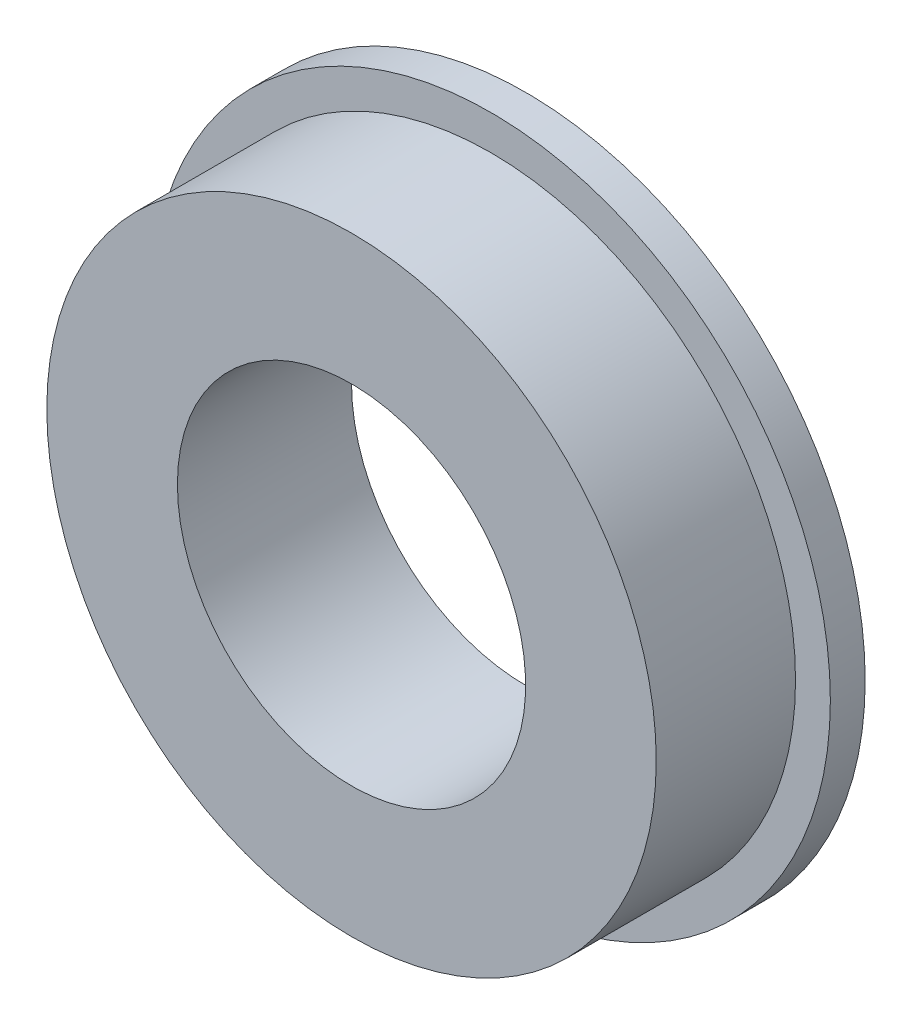
from build123d import *

# Parameters (mm, degrees)
SKETCH_1_R          = 7.8
EXTRUDE_1_DEPTH     = 0.8
SKETCH_2_R          = 7
EXTRUDE_2_DEPTH     = 3.2
SKETCH_3_R          = 4
CUT_EXTRUDE_1_DEPTH = 12.733712115


with BuildPart() as part:
    # 草图1 → 凸台-拉伸1 (new body)
    with BuildSketch(Plane.XY):
        Circle(SKETCH_1_R)
    extrude(amount=EXTRUDE_1_DEPTH)

    # 草图2 → 凸台-拉伸2 (add)
    with BuildSketch(Plane.XY.offset(0.8)):
        Circle(SKETCH_2_R)
    extrude(amount=EXTRUDE_2_DEPTH)

    # 草图3 → 切除-拉伸1 (cut, through all)
    with BuildSketch(Plane(origin=(0, 0, 0), x_dir=(-1, 0, 0), z_dir=(0, 0, -1))):
        Circle(SKETCH_3_R)
    extrude(amount=-CUT_EXTRUDE_1_DEPTH, mode=Mode.SUBTRACT)


solid = part.part
